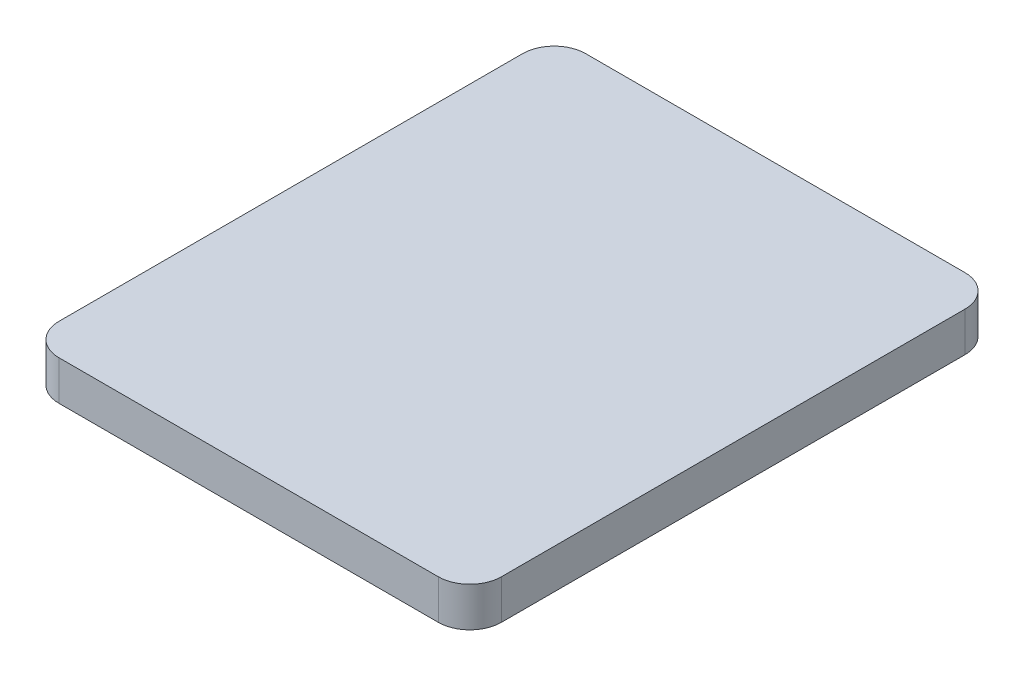
from build123d import *

# Parameters (mm, degrees)
SKETCH1_W           = 42
SKETCH1_H           = 50
BOSS_EXTRUDE1_DEPTH = 3.75
FILLET1_R           = 3


with BuildPart() as part:
    # Sketch1 → Boss-Extrude1 (new body)
    with BuildSketch(Plane(origin=(0, 0, 0), x_dir=(1, 0, 0), z_dir=(0, 1, 0))):
        with Locations((21, 25)):
            Rectangle(SKETCH1_W, SKETCH1_H)
    extrude(amount=BOSS_EXTRUDE1_DEPTH)

    # Fillet1
    fillet1_edges = [part.edges().sort_by_distance(p)[0] for p in [
        (0, 1.875, -50),
        (42, 1.875, -50),
        (42, 1.875, 0),
        (0, 1.875, 0),
    ]]
    fillet(fillet1_edges, radius=FILLET1_R)


solid = part.part
